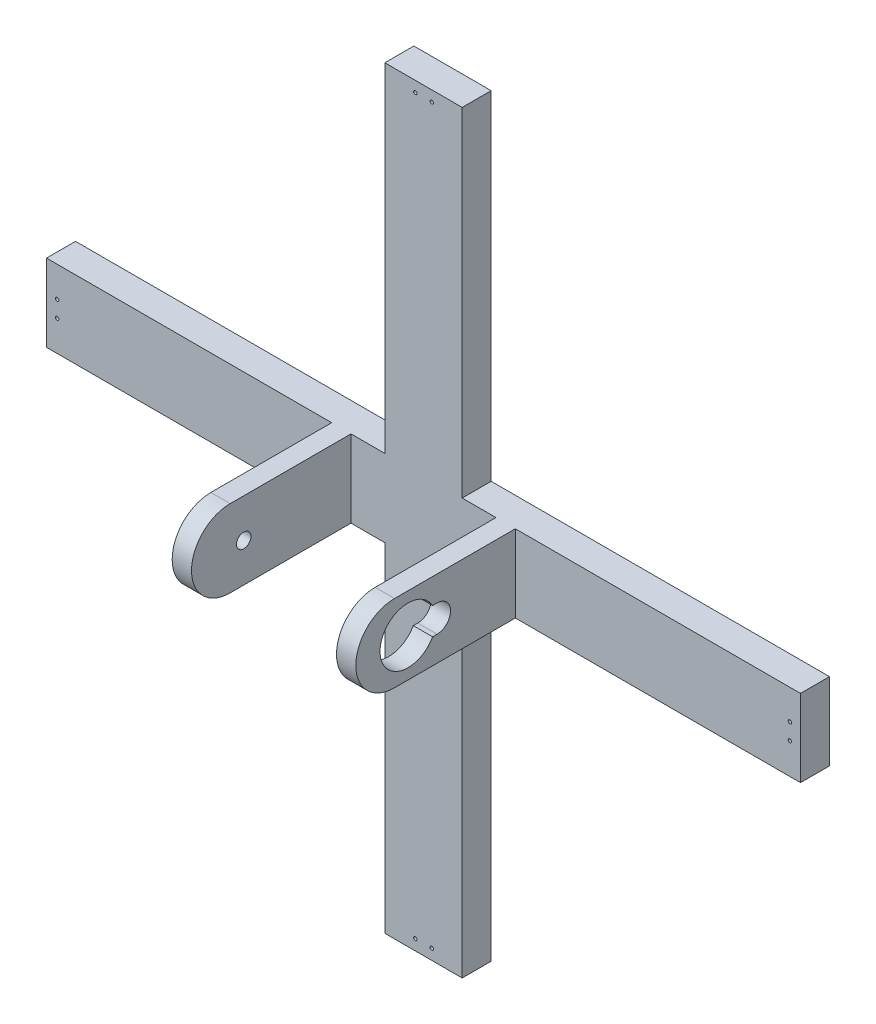
from build123d import *

# Parameters (mm, degrees)
Y_KSEKLIK_EKSTR_ZYON1_DEPTH = 3
IZIM2_R                     = 0.35
KES_EKSTR_ZYON1_DEPTH       = 5
IZIM3_W                     = 4
IZIM3_H                     = 16
Y_KSEKLIK_EKSTR_ZYON4_DEPTH = 36
KES_EKSTR_ZYON2_DEPTH       = 122.556571192
KES_EKSTR_ZYON2_DEPTH_BACK  = 122.556571192
KES_EKSTR_ZYON3_DEPTH       = 100
IZIM8_R                     = 1.5
KES_EKSTR_ZYON4_DEPTH       = 30


with BuildPart() as part:
    # Çizim1 → Yükseklik-Ekstrüzyon1 (new, symmetric)
    with BuildSketch(Plane.XY):
        Polygon((8, 70), (-8, 70), (-8, 0), (-78, 0), (-78, -16), (-8, -16), (-8, -86), (8, -86), (8, -16), (78, -16), (78, 0), (8, 0), align=None)
    extrude(amount=Y_KSEKLIK_EKSTR_ZYON1_DEPTH, both=True)

    # Çizim2 → Kes-Ekstrüzyon1 (cut, symmetric)
    with BuildSketch(Plane.XY):
        with Locations(Location((-75.8, -6.3, 0), (0, 0, 180))):
            Circle(IZIM2_R)
        with Locations(Location((-75.8, -9.7, 0), (0, 0, 180))):
            Circle(IZIM2_R)
        with Locations(Location((-1.7, 67.8, 0), (0, 0, 180))):
            Circle(IZIM2_R)
        with Locations(Location((1.7, 67.8, 0), (0, 0, 180))):
            Circle(IZIM2_R)
        with Locations(Location((75.804898835, -6.19877905, 0), (0, 0, 180))):
            Circle(IZIM2_R)
        with Locations(Location((75.804898835, -9.59877905, 0), (0, 0, 180))):
            Circle(IZIM2_R)
        with Locations((-75.804898835, 141.79877905)):
            Circle(IZIM2_R)
        with Locations((-75.804898835, 145.19877905)):
            Circle(IZIM2_R)
        with Locations((73.99877905, 143.604898835)):
            Circle(IZIM2_R)
        with Locations((77.39877905, 143.604898835)):
            Circle(IZIM2_R)
        with Locations(Location((-1.7, -83.8, 0), (0, 0, 180))):
            Circle(IZIM2_R)
        with Locations(Location((1.7, -83.8, 0), (0, 0, 180))):
            Circle(IZIM2_R)
    extrude(amount=KES_EKSTR_ZYON1_DEPTH, both=True, mode=Mode.SUBTRACT)

    # Çizim3 → Yükseklik-Ekstrüzyon4 (add)
    with BuildSketch(Plane.XY):
        with Locations((-17, -8)):
            Rectangle(IZIM3_W, IZIM3_H)
        with Locations((17, -8)):
            Rectangle(IZIM3_W, IZIM3_H)
    extrude(amount=Y_KSEKLIK_EKSTR_ZYON4_DEPTH)

    # Çizim6 → Kes-Ekstrüzyon2 (cut, two sides: drawn at the far end of the back side and taken through both)
    with BuildSketch(Plane(origin=(0, 0, 0), x_dir=(0, 0, -1), z_dir=(1, 0, 0)).offset(-KES_EKSTR_ZYON2_DEPTH_BACK)):
        with BuildLine():
            Line((-36, 0), (-39.977521608, 0))
            Line((-39.977521608, 0), (-39.977521608, -16))
            Line((-39.977521608, -16), (-36, -16))
            Line((-36, -16), (-28, -16))
            ThreePointArc((-28, -16), (-36, -8), (-28, 0))
            Line((-28, 0), (-36, 0))
        make_face()
    extrude(amount=KES_EKSTR_ZYON2_DEPTH + KES_EKSTR_ZYON2_DEPTH_BACK, mode=Mode.SUBTRACT)

    # Çizim7 → Kes-Ekstrüzyon3 (cut)
    with BuildSketch(Plane(origin=(0, 0, 0), x_dir=(0, 0, -1), z_dir=(1, 0, 0))):
        with BuildLine():
            Line((-19.2, -5.2), (-20.12062996, -5.2))
            ThreePointArc((-20.12062996, -5.2), (-31, -8), (-20.12062996, -10.8))
            Line((-20.12062996, -10.8), (-19.2, -10.8))
            ThreePointArc((-19.2, -10.8), (-16.4, -8), (-19.2, -5.2))
        make_face()
    extrude(amount=KES_EKSTR_ZYON3_DEPTH, mode=Mode.SUBTRACT)

    # Çizim8 → Kes-Ekstrüzyon4 (cut)
    with BuildSketch(Plane(origin=(-9.5, 0, 0), x_dir=(0, 0, -1), z_dir=(1, 0, 0))):
        with Locations((-25.2, -8)):
            Circle(IZIM8_R)
    extrude(amount=-KES_EKSTR_ZYON4_DEPTH, mode=Mode.SUBTRACT)


solid = part.part
